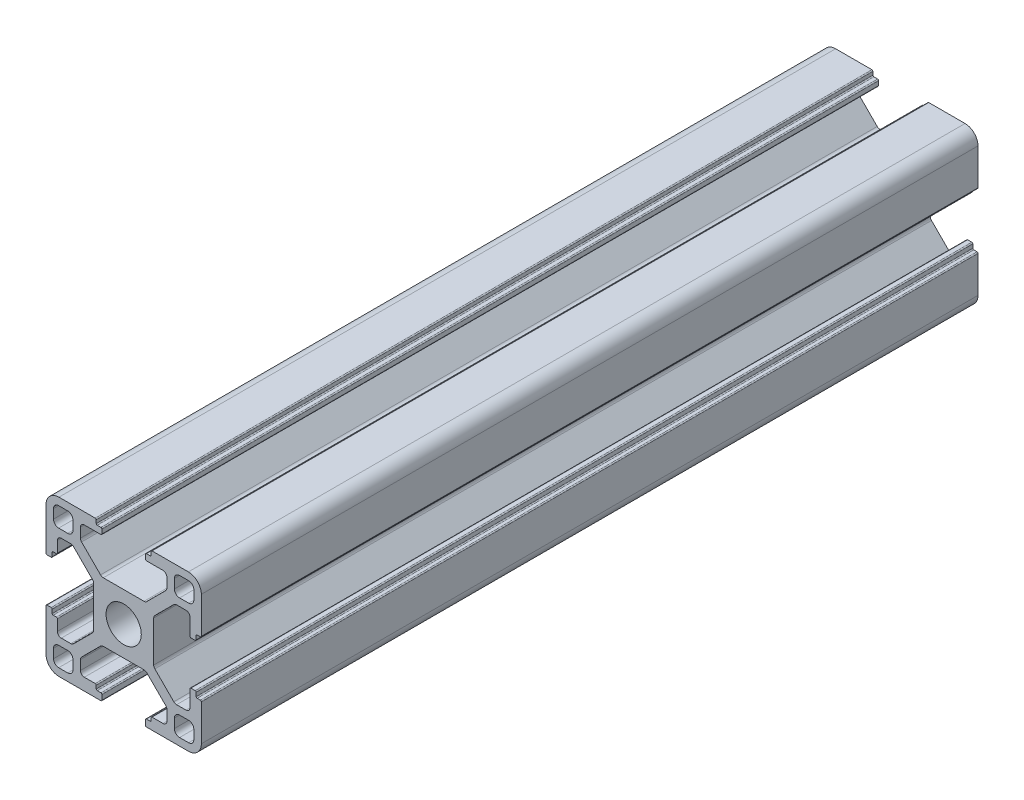
from build123d import *

# Parameters (mm, degrees)
SKETCH1_R           = 3.4
BOSS_EXTRUDE1_DEPTH = 150


with BuildPart() as part:
    # Sketch1 → Boss-Extrude1 (new body)
    with BuildSketch(Plane.XY):
        with BuildLine():
            Line((0, 2.5), (0, 10.6))
            ThreePointArc((0, 10.6), (0.058578644, 10.741421356), (0.2, 10.8))
            Line((0.2, 10.8), (1, 10.8))
            ThreePointArc((1, 10.8), (1.141421356, 10.741421356), (1.2, 10.6))
            Line((1.2, 10.6), (1.2, 9.9))
            ThreePointArc((1.2, 9.9), (1.258578644, 9.758578644), (1.4, 9.7))
            Line((1.4, 9.7), (2, 9.7))
            ThreePointArc((2, 9.7), (2.141421356, 9.641421356), (2.2, 9.5))
            Line((2.2, 9.5), (2.2, 7.4))
            ThreePointArc((2.2, 7.4), (2.419669914, 6.869669914), (2.95, 6.65))
            Line((2.95, 6.65), (4.78370491, 6.65))
            ThreePointArc((4.78370491, 6.65), (5.070717484, 6.707090351), (5.314034995, 6.869669914))
            Line((5.314034995, 6.869669914), (8.980330086, 10.535965005))
            ThreePointArc((8.980330086, 10.535965005), (9.142909649, 10.779282516), (9.2, 11.06629509))
            Line((9.2, 11.06629509), (9.2, 18.93370491))
            ThreePointArc((9.2, 18.93370491), (9.142909649, 19.220717484), (8.980330086, 19.464034995))
            Line((8.980330086, 19.464034995), (5.314034995, 23.130330086))
            ThreePointArc((5.314034995, 23.130330086), (5.070717484, 23.292909649), (4.78370491, 23.35))
            Line((4.78370491, 23.35), (2.95, 23.35))
            ThreePointArc((2.95, 23.35), (2.419669914, 23.130330086), (2.2, 22.6))
            Line((2.2, 22.6), (2.2, 20.5))
            ThreePointArc((2.2, 20.5), (2.141421356, 20.358578644), (2, 20.3))
            Line((2, 20.3), (1.4, 20.3))
            ThreePointArc((1.4, 20.3), (1.258578644, 20.241421356), (1.2, 20.1))
            Line((1.2, 20.1), (1.2, 19.4))
            ThreePointArc((1.2, 19.4), (1.141421356, 19.258578644), (1, 19.2))
            Line((1, 19.2), (0.2, 19.2))
            ThreePointArc((0.2, 19.2), (0.058578644, 19.258578644), (0, 19.4))
            Line((0, 19.4), (0, 27.5))
            ThreePointArc((0, 27.5), (0.732233047, 29.267766953), (2.5, 30))
            Line((2.5, 30), (9.5, 30))
            ThreePointArc((9.5, 30), (9.641421356, 29.941421356), (9.7, 29.8))
            Line((9.7, 29.8), (9.7, 29.2))
            ThreePointArc((9.7, 29.2), (9.758578644, 29.058578644), (9.9, 29))
            Line((9.9, 29), (10.6, 29))
            ThreePointArc((10.6, 29), (10.741421356, 28.941421356), (10.8, 28.8))
            Line((10.8, 28.8), (10.8, 28))
            ThreePointArc((10.8, 28), (10.741421356, 27.858578644), (10.6, 27.8))
            Line((10.6, 27.8), (7.4, 27.8))
            ThreePointArc((7.4, 27.8), (6.869669914, 27.580330086), (6.65, 27.05))
            Line((6.65, 27.05), (6.65, 25.21629509))
            ThreePointArc((6.65, 25.21629509), (6.707090351, 24.929282516), (6.869669914, 24.685965005))
            Line((6.869669914, 24.685965005), (10.535965005, 21.019669914))
            ThreePointArc((10.535965005, 21.019669914), (10.779282516, 20.857090351), (11.06629509, 20.8))
            Line((11.06629509, 20.8), (18.93370491, 20.8))
            ThreePointArc((18.93370491, 20.8), (19.220717484, 20.857090351), (19.464034995, 21.019669914))
            Line((19.464034995, 21.019669914), (23.130330086, 24.685965005))
            ThreePointArc((23.130330086, 24.685965005), (23.292909649, 24.929282516), (23.35, 25.21629509))
            Line((23.35, 25.21629509), (23.35, 27.05))
            ThreePointArc((23.35, 27.05), (23.130330086, 27.580330086), (22.6, 27.8))
            Line((22.6, 27.8), (19.4, 27.8))
            ThreePointArc((19.4, 27.8), (19.258578644, 27.858578644), (19.2, 28))
            Line((19.2, 28), (19.2, 28.8))
            ThreePointArc((19.2, 28.8), (19.258578644, 28.941421356), (19.4, 29))
            Line((19.4, 29), (20.1, 29))
            ThreePointArc((20.1, 29), (20.241421356, 29.058578644), (20.3, 29.2))
            Line((20.3, 29.2), (20.3, 29.8))
            ThreePointArc((20.3, 29.8), (20.358578644, 29.941421356), (20.5, 30))
            Line((20.5, 30), (27.5, 30))
            ThreePointArc((27.5, 30), (29.267766953, 29.267766953), (30, 27.5))
            Line((30, 27.5), (30, 20.5))
            ThreePointArc((30, 20.5), (29.941421356, 20.358578644), (29.8, 20.3))
            Line((29.8, 20.3), (29.2, 20.3))
            ThreePointArc((29.2, 20.3), (29.058578644, 20.241421356), (29, 20.1))
            Line((29, 20.1), (29, 19.4))
            ThreePointArc((29, 19.4), (28.941421356, 19.258578644), (28.8, 19.2))
            Line((28.8, 19.2), (28, 19.2))
            ThreePointArc((28, 19.2), (27.858578644, 19.258578644), (27.8, 19.4))
            Line((27.8, 19.4), (27.8, 22.6))
            ThreePointArc((27.8, 22.6), (27.580330086, 23.130330086), (27.05, 23.35))
            Line((27.05, 23.35), (25.21629509, 23.35))
            ThreePointArc((25.21629509, 23.35), (24.929282516, 23.292909649), (24.685965005, 23.130330086))
            Line((24.685965005, 23.130330086), (21.019669914, 19.464034995))
            ThreePointArc((21.019669914, 19.464034995), (20.857090351, 19.220717484), (20.8, 18.93370491))
            Line((20.8, 18.93370491), (20.8, 11.06629509))
            ThreePointArc((20.8, 11.06629509), (20.857090351, 10.779282516), (21.019669914, 10.535965005))
            Line((21.019669914, 10.535965005), (24.685965005, 6.869669914))
            ThreePointArc((24.685965005, 6.869669914), (24.929282516, 6.707090351), (25.21629509, 6.65))
            Line((25.21629509, 6.65), (27.05, 6.65))
            ThreePointArc((27.05, 6.65), (27.580330086, 6.869669914), (27.8, 7.4))
            Line((27.8, 7.4), (27.8, 10.6))
            ThreePointArc((27.8, 10.6), (27.858578644, 10.741421356), (28, 10.8))
            Line((28, 10.8), (28.8, 10.8))
            ThreePointArc((28.8, 10.8), (28.941421356, 10.741421356), (29, 10.6))
            Line((29, 10.6), (29, 9.9))
            ThreePointArc((29, 9.9), (29.058578644, 9.758578644), (29.2, 9.7))
            Line((29.2, 9.7), (29.8, 9.7))
            ThreePointArc((29.8, 9.7), (29.941421356, 9.641421356), (30, 9.5))
            Line((30, 9.5), (30, 2.5))
            ThreePointArc((30, 2.5), (29.267766953, 0.732233047), (27.5, 0))
            Line((27.5, 0), (19.4, 0))
            ThreePointArc((19.4, 0), (19.258578644, 0.058578644), (19.2, 0.2))
            Line((19.2, 0.2), (19.2, 1.132430858))
            ThreePointArc((19.2, 1.132430858), (19.258578644, 1.273852214), (19.4, 1.332430858))
            Line((19.4, 1.332430858), (20.1, 1.332430858))
            ThreePointArc((20.1, 1.332430858), (20.241421356, 1.391009502), (20.3, 1.532430858))
            Line((20.3, 1.532430858), (20.3, 2))
            ThreePointArc((20.3, 2), (20.358578644, 2.141421356), (20.5, 2.2))
            Line((20.5, 2.2), (22.6, 2.2))
            ThreePointArc((22.6, 2.2), (23.130330086, 2.419669914), (23.35, 2.95))
            Line((23.35, 2.95), (23.35, 4.916135768))
            ThreePointArc((23.35, 4.916135768), (23.292909649, 5.203148342), (23.130330086, 5.446465854))
            Line((23.130330086, 5.446465854), (19.464034995, 9.112760944))
            ThreePointArc((19.464034995, 9.112760944), (19.220717484, 9.275340508), (18.93370491, 9.332430858))
            Line((18.93370491, 9.332430858), (11.06629509, 9.332430858))
            ThreePointArc((11.06629509, 9.332430858), (10.779282516, 9.275340508), (10.535965005, 9.112760944))
            Line((10.535965005, 9.112760944), (6.869669914, 5.446465854))
            ThreePointArc((6.869669914, 5.446465854), (6.707090351, 5.203148342), (6.65, 4.916135768))
            Line((6.65, 4.916135768), (6.65, 3.082430858))
            ThreePointArc((6.65, 3.082430858), (6.869669914, 2.552100772), (7.4, 2.332430858))
            Line((7.4, 2.332430858), (9.5, 2.332430858))
            ThreePointArc((9.5, 2.332430858), (9.641421356, 2.273852214), (9.7, 2.132430858))
            Line((9.7, 2.132430858), (9.7, 1.532430858))
            ThreePointArc((9.7, 1.532430858), (9.758578644, 1.391009502), (9.9, 1.332430858))
            Line((9.9, 1.332430858), (10.6, 1.332430858))
            ThreePointArc((10.6, 1.332430858), (10.741421356, 1.273852214), (10.8, 1.132430858))
            Line((10.8, 1.132430858), (10.8, 0.2))
            ThreePointArc((10.8, 0.2), (10.741421356, 0.058578644), (10.6, 0))
            Line((10.6, 0), (2.5, 0))
            ThreePointArc((2.5, 0), (0.732233047, 0.732233047), (0, 2.5))
        make_face()
        with Locations((15, 15)):
            Circle(SKETCH1_R, mode=Mode.SUBTRACT)
        with BuildLine():
            Line((27.55, 1.45), (25.8, 1.45))
            ThreePointArc((25.8, 1.45), (25.092893219, 1.742893219), (24.8, 2.45))
            Line((24.8, 2.45), (24.8, 4.2))
            ThreePointArc((24.8, 4.2), (25.092893219, 4.907106781), (25.8, 5.2))
            Line((25.8, 5.2), (27.55, 5.2))
            ThreePointArc((27.55, 5.2), (28.257106781, 4.907106781), (28.55, 4.2))
            Line((28.55, 4.2), (28.55, 2.45))
            ThreePointArc((28.55, 2.45), (28.257106781, 1.742893219), (27.55, 1.45))
        make_face(mode=Mode.SUBTRACT)
        with BuildLine():
            Line((24.8, 25.8), (24.8, 27.55))
            ThreePointArc((24.8, 27.55), (25.092893219, 28.257106781), (25.8, 28.55))
            Line((25.8, 28.55), (27.55, 28.55))
            ThreePointArc((27.55, 28.55), (28.257106781, 28.257106781), (28.55, 27.55))
            Line((28.55, 27.55), (28.55, 25.8))
            ThreePointArc((28.55, 25.8), (28.257106781, 25.092893219), (27.55, 24.8))
            Line((27.55, 24.8), (25.8, 24.8))
            ThreePointArc((25.8, 24.8), (25.092893219, 25.092893219), (24.8, 25.8))
        make_face(mode=Mode.SUBTRACT)
        with BuildLine():
            Line((2.45, 28.55), (4.2, 28.55))
            ThreePointArc((4.2, 28.55), (4.907106781, 28.257106781), (5.2, 27.55))
            Line((5.2, 27.55), (5.2, 25.8))
            ThreePointArc((5.2, 25.8), (4.907106781, 25.092893219), (4.2, 24.8))
            Line((4.2, 24.8), (2.45, 24.8))
            ThreePointArc((2.45, 24.8), (1.742893219, 25.092893219), (1.45, 25.8))
            Line((1.45, 25.8), (1.45, 27.55))
            ThreePointArc((1.45, 27.55), (1.742893219, 28.257106781), (2.45, 28.55))
        make_face(mode=Mode.SUBTRACT)
        with BuildLine():
            Line((1.45, 2.45), (1.45, 4.2))
            ThreePointArc((1.45, 4.2), (1.742893219, 4.907106781), (2.45, 5.2))
            Line((2.45, 5.2), (4.2, 5.2))
            ThreePointArc((4.2, 5.2), (4.907106781, 4.907106781), (5.2, 4.2))
            Line((5.2, 4.2), (5.2, 2.45))
            ThreePointArc((5.2, 2.45), (4.907106781, 1.742893219), (4.2, 1.45))
            Line((4.2, 1.45), (2.45, 1.45))
            ThreePointArc((2.45, 1.45), (1.742893219, 1.742893219), (1.45, 2.45))
        make_face(mode=Mode.SUBTRACT)
    extrude(amount=BOSS_EXTRUDE1_DEPTH)


solid = part.part
